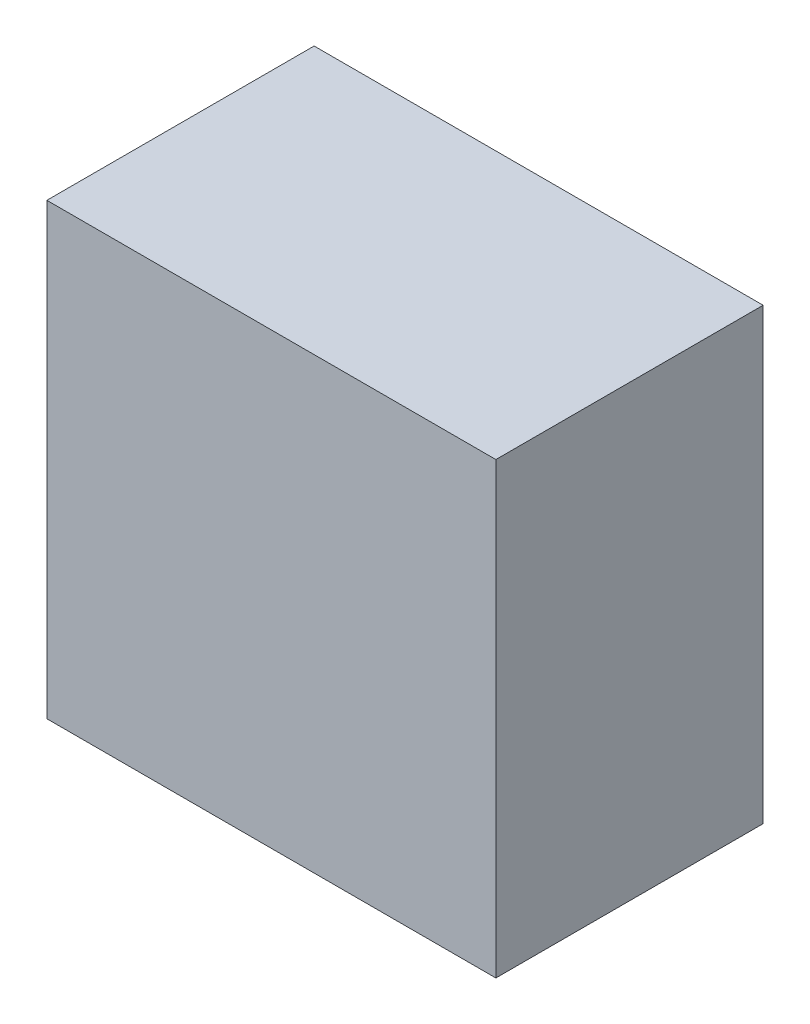
from build123d import *

# Parameters (mm, degrees)
ESBO_O1_W                = 42
ESBO_O1_H                = 42
RESSALTO_EXTRUS_O1_DEPTH = 25


with BuildPart() as part:
    # Esboço1 → Ressalto-extrusão1 (new body)
    with BuildSketch(Plane.XY):
        Rectangle(ESBO_O1_W, ESBO_O1_H)
    extrude(amount=RESSALTO_EXTRUS_O1_DEPTH)


solid = part.part
